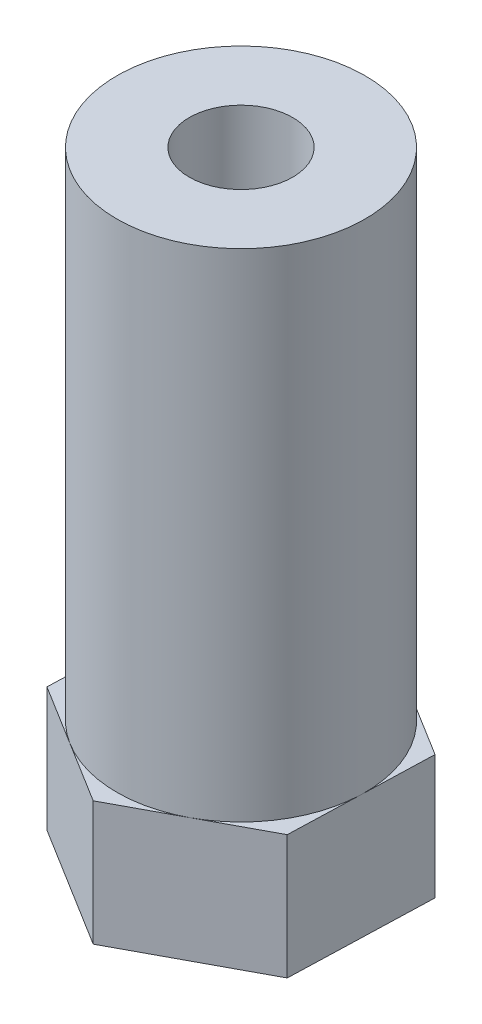
from build123d import *

# Parameters (mm, degrees)
EXTRUDE_1_DEPTH     = 6
SKETCH_2_R          = 6
EXTRUDE_2_DEPTH     = 24
SKETCH_3_R          = 2.5
CUT_EXTRUDE_1_DEPTH = 24
SKETCH_4_R          = 2
CUT_EXTRUDE_2_DEPTH = 6


with BuildPart() as part:
    # 草图1 → 凸台-拉伸1 (new body)
    with BuildSketch(Plane(origin=(0, 0, 0), x_dir=(1, 0, 0), z_dir=(0, 1, 0))):
        Polygon((5.88746988, -3.652081381), (6.106530193, 3.27265779), (0.219060313, 6.92473917), (-5.88746988, 3.652081381), (-6.106530193, -3.27265779), (-0.219060313, -6.92473917), align=None)
    extrude(amount=EXTRUDE_1_DEPTH)

    # 草图2 → 凸台-拉伸2 (add)
    with BuildSketch(Plane(origin=(0, 6, 0), x_dir=(1, 0, 0), z_dir=(0, 1, 0))):
        with Locations(Location((0, 0, 0), (0, 0, 118.188083805))):
            Circle(SKETCH_2_R)
    extrude(amount=EXTRUDE_2_DEPTH)

    # 草图3 → 切除-拉伸1 (cut)
    with BuildSketch(Plane(origin=(0, 30, 0), x_dir=(1, 0, 0), z_dir=(0, 1, 0))):
        with Locations(Location((0, 0, 0), (0, 0, 270))):
            Circle(SKETCH_3_R)
    extrude(amount=-CUT_EXTRUDE_1_DEPTH, mode=Mode.SUBTRACT)

    # 草图4 → 切除-拉伸2 (cut)
    with BuildSketch(Plane.XZ):
        with Locations(Location((0, 0, 0), (0, 0, 270))):
            Circle(SKETCH_4_R)
    extrude(amount=-CUT_EXTRUDE_2_DEPTH, mode=Mode.SUBTRACT)


solid = part.part
